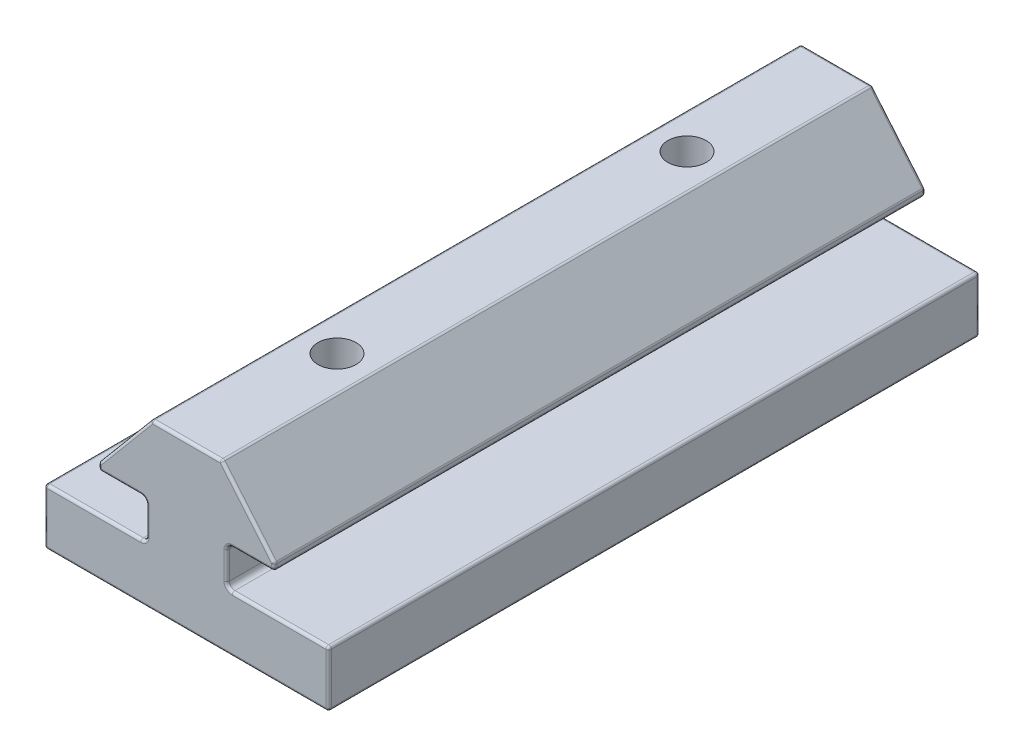
from build123d import *

# Parameters (mm, degrees)
BOSS_EXTRUDE1_DEPTH = 23.622
SKETCH5_R           = 1.3843
CUT_EXTRUDE1_DEPTH  = 29.405286863
FILLET1_R           = 0.396875
FILLET2_R           = 0.1984375


with BuildPart() as part:
    # Sketch3 → Boss-Extrude1 (new, symmetric)
    with BuildSketch(Plane.XY):
        Polygon((-6.376363514, 1.397), (-6.376363514, 0.889), (-2.921, 0.889), (-2.921, -1.905), (-10.3124, -1.905), (-10.3124, -5.969), (10.3124, -5.969), (10.3124, -1.905), (2.921, -1.905), (2.921, 0.889), (6.376363514, 0.889), (6.376363514, 1.397), (2.54, 5.969), (-2.54, 5.969), align=None)
    extrude(amount=BOSS_EXTRUDE1_DEPTH, both=True)

    # Sketch5 → Cut-Extrude1 (cut, through all)
    with BuildSketch(Plane.XZ.offset(5.969)):
        with Locations(Location((0, 12.7, 0), (0, 0, 270))):
            Circle(SKETCH5_R)
        with Locations(Location((0, -12.7, 0), (0, 0, 270))):
            Circle(SKETCH5_R)
    extrude(amount=-CUT_EXTRUDE1_DEPTH, mode=Mode.SUBTRACT)

    # Fillet1
    fillet1_edges = [part.edges().sort_by_distance(p)[0] for p in [
        (2.921, 0.889, 0),
        (2.921, -1.905, 0),
        (-2.921, -1.905, 0),
        (-2.921, 0.889, 0),
    ]]
    fillet(fillet1_edges, radius=FILLET1_R)

    # Fillet2
    fillet2_edges = [part.edges().sort_by_distance(p)[0] for p in [
        (-4.847119257, 0.889, 23.622),
        (0, 5.969, -23.622),
        (4.458181757, 3.683, -23.622),
        (6.376363514, 1.143, -23.622),
        (6.8151375, -1.905, -23.622),
        (10.3124, -3.937, -23.622),
        (0, -5.969, -23.622),
        (-10.3124, -3.937, -23.622),
        (-4.847119257, 0.889, -23.622),
        (-6.376363514, 1.143, -23.622),
        (-4.458181757, 3.683, -23.622),
        (-10.3124, -3.937, 23.622),
        (0, -5.969, 23.622),
        (-2.54, 5.969, 0),
        (2.54, 5.969, 0),
        (6.376363514, 1.397, 0),
        (6.376363514, 0.889, 0),
        (10.3124, -1.905, 0),
        (10.3124, -5.969, 0),
        (-10.3124, -5.969, 0),
        (-10.3124, -1.905, 0),
        (-6.376363514, 0.889, 0),
        (-6.376363514, 1.397, 0),
        (10.3124, -3.937, 23.622),
        (6.8151375, -1.905, 23.622),
        (6.376363514, 1.143, 23.622),
        (-4.458181757, 3.683, 23.622),
        (4.458181757, 3.683, 23.622),
        (0, 5.969, 23.622),
        (4.847119257, 0.889, -23.622),
        (4.847119257, 0.889, 23.622),
        (2.921, -0.508, -23.622),
        (2.921, -0.508, 23.622),
        (-2.921, -0.508, -23.622),
        (-2.921, -0.508, 23.622),
        (-6.8151375, -1.905, -23.622),
        (-6.8151375, -1.905, 23.622),
        (3.037241996, 0.772758004, -23.622),
        (3.037241996, 0.772758004, 23.622),
        (-3.037241996, 0.772758004, -23.622),
        (-3.037241996, 0.772758004, 23.622),
        (-3.037241996, -1.788758004, -23.622),
        (-3.037241996, -1.788758004, 23.622),
        (3.037241996, -1.788758004, -23.622),
        (3.037241996, -1.788758004, 23.622),
        (-6.376363514, 1.143, 23.622),
    ]]
    fillet(fillet2_edges, radius=FILLET2_R)


solid = part.part
